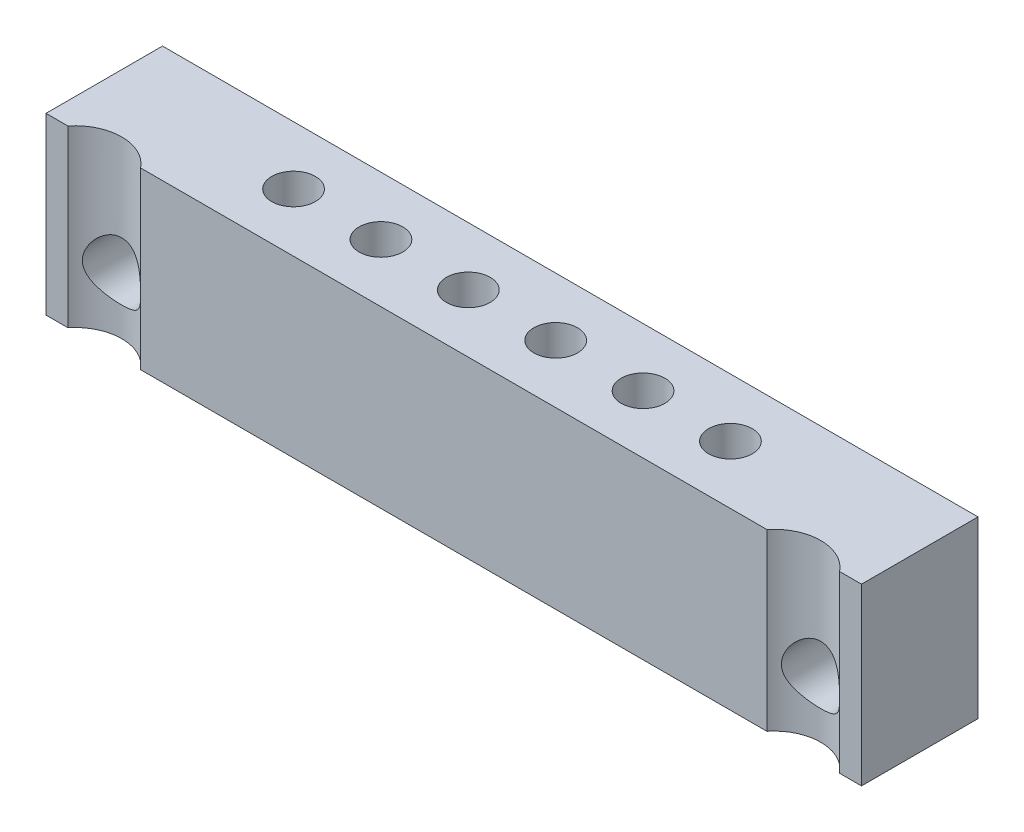
from build123d import *

# Parameters (mm, degrees)
CROQUIS1_W              = 28
CROQUIS1_H              = 6
CROQUIS1_R              = 1
SALIENTE_EXTRUIR1_DEPTH = 4
CROQUIS2_R              = 1.6
CROQUIS2_R_2            = 0.75
CORTAR_EXTRUIR1_DEPTH   = 6


with BuildPart() as part:
    # Croquis1 → Saliente-Extruir1 (new body)
    with BuildSketch(Plane.XY):
        with Locations((14, 3)):
            Rectangle(CROQUIS1_W, CROQUIS1_H)
        with Locations((2, 2)):
            Circle(CROQUIS1_R, mode=Mode.SUBTRACT)
        with Locations(Location((26, 2, 0), (0, 0, 180))):
            Circle(CROQUIS1_R, mode=Mode.SUBTRACT)
    extrude(amount=SALIENTE_EXTRUIR1_DEPTH)

    # Croquis2 → Cortar-Extruir1 (cut)
    with BuildSketch(Plane.XZ):
        with Locations((2, 5)):
            Circle(CROQUIS2_R)
        with Locations(Location((12.5, 2, 0), (0, 0, 270))):
            Circle(CROQUIS2_R_2)
        with Locations(Location((9.5, 2, 0), (0, 0, 270))):
            Circle(CROQUIS2_R_2)
        with Locations(Location((6.5, 2, 0), (0, 0, 270))):
            Circle(CROQUIS2_R_2)
        with Locations(Location((21.5, 2, 0), (0, 0, 90))):
            Circle(CROQUIS2_R_2)
        with Locations(Location((18.5, 2, 0), (0, 0, 90))):
            Circle(CROQUIS2_R_2)
        with Locations(Location((15.5, 2, 0), (0, 0, 90))):
            Circle(CROQUIS2_R_2)
        with Locations((26, 5)):
            Circle(CROQUIS2_R)
    extrude(amount=-CORTAR_EXTRUIR1_DEPTH, mode=Mode.SUBTRACT)


solid = part.part
